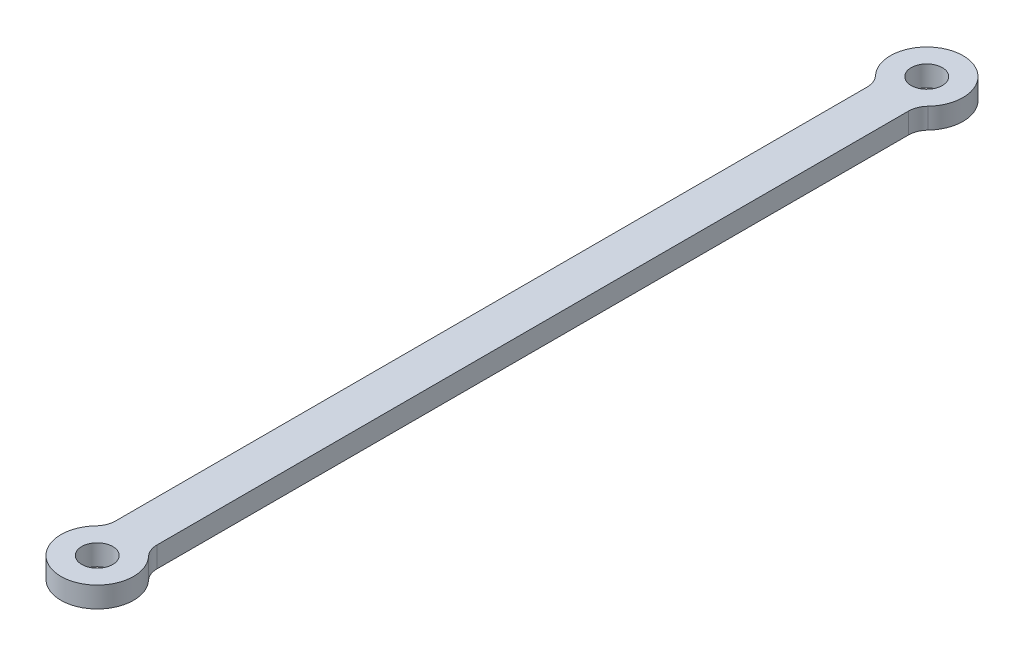
from build123d import *

# Parameters (mm, degrees)
SKETCH1_R           = 1.905
BOSS_EXTRUDE1_DEPTH = 2.54
FILLET1_R           = 2.54


with BuildPart() as part:
    # Sketch1 → Boss-Extrude1 (new body)
    with BuildSketch(Plane(origin=(0, 0, 0), x_dir=(1, 0, 0), z_dir=(0, 1, 0))):
        with BuildLine():
            Line((2.54, 3.647797281), (2.54, 97.952202719))
            ThreePointArc((2.54, 97.952202719), (0, 106.045), (-2.54, 97.952202719))
            Line((-2.54, 97.952202719), (-2.54, 3.647797281))
            ThreePointArc((-2.54, 3.647797281), (0, -4.445), (2.54, 3.647797281))
        make_face()
        with Locations(Location((0, 101.6, 0), (0, 0, 270))):
            Circle(SKETCH1_R, mode=Mode.SUBTRACT)
        with Locations(Location((0, 0, 0), (0, 0, 270))):
            Circle(SKETCH1_R, mode=Mode.SUBTRACT)
    extrude(amount=BOSS_EXTRUDE1_DEPTH)

    # Fillet1
    fillet1_edges = [part.edges().sort_by_distance(p)[0] for p in [
        (-2.54, 1.27, -3.647797281),
        (-2.54, 1.27, -97.952202719),
        (2.54, 1.27, -97.952202719),
        (2.54, 1.27, -3.647797281),
    ]]
    fillet(fillet1_edges, radius=FILLET1_R)


solid = part.part
